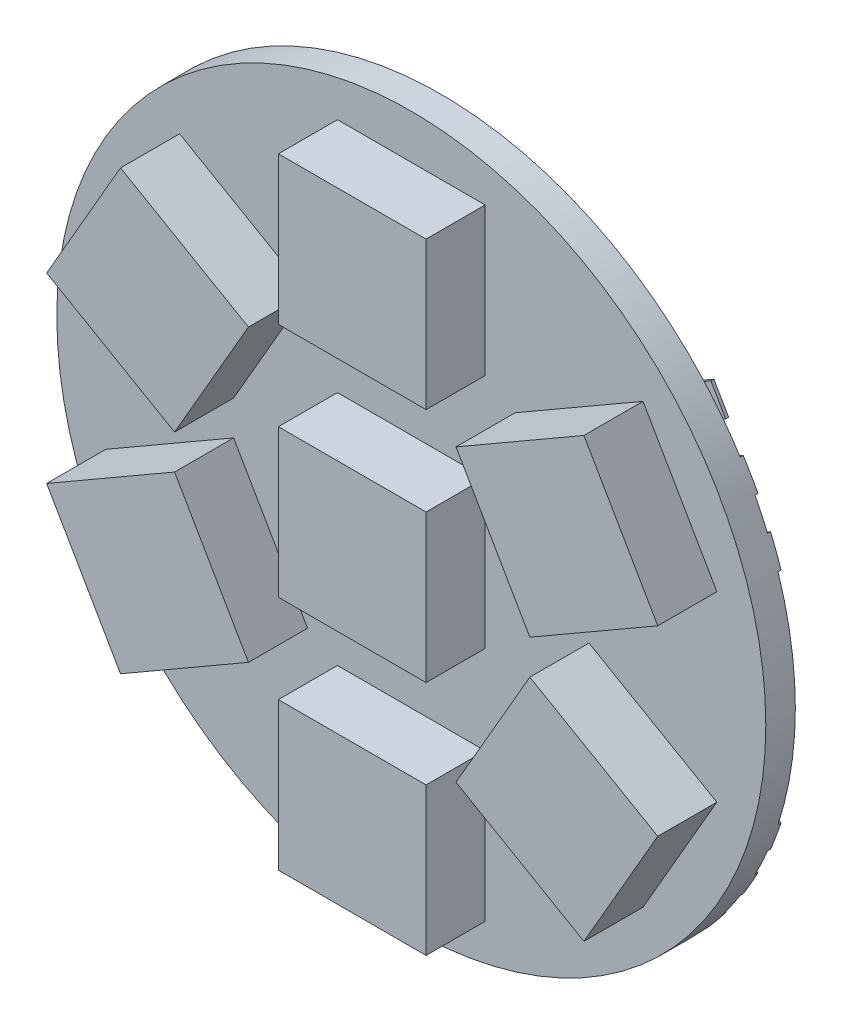
from build123d import *
from build123d.topology import SkipClean

# Parameters (mm, degrees)
CROQUIS1_R              = 12
SALIENTE_EXTRUIR1_DEPTH = 1
CROQUIS2_W              = 5
CROQUIS2_H              = 5
SALIENTE_EXTRUIR2_DEPTH = 2
SALIENTE_EXTRUIR3_START = 0.1
SALIENTE_EXTRUIR3_DEPTH = 0.1


with BuildPart() as part:
    # Croquis1 → Saliente-Extruir1 (new body)
    with BuildSketch(Plane.XY):
        Circle(CROQUIS1_R)
    extrude(amount=SALIENTE_EXTRUIR1_DEPTH)

    # Croquis2 → Saliente-Extruir2 (add)
    with BuildSketch(Plane.XY.offset(1)):
        Rectangle(CROQUIS2_W, CROQUIS2_H)
        with Locations((0, -8)):
            Rectangle(CROQUIS2_W, CROQUIS2_H)
        with Locations((0, 8)):
            Rectangle(CROQUIS2_W, CROQUIS2_H)
        Polygon((-7.84326674, 7.415063509), (-10.34326674, 3.084936491), (-6.013139721, 0.584936491), (-3.513139721, 4.915063509), align=None)
        Polygon((-6.013139721, -0.584936491), (-10.34326674, -3.084936491), (-7.84326674, -7.415063509), (-3.513139721, -4.915063509), align=None)
        Polygon((6.013139721, -0.584936491), (3.513139721, -4.915063509), (7.84326674, -7.415063509), (10.34326674, -3.084936491), align=None)
        Polygon((7.84326674, 7.415063509), (3.513139721, 4.915063509), (6.013139721, 0.584936491), (10.34326674, 3.084936491), align=None)
    extrude(amount=SALIENTE_EXTRUIR2_DEPTH)

    # Croquis3 → Saliente-Extruir3 (add)
    with SkipClean():  # the faces are left unmerged after this step: merging them gives an invalid solid
        with BuildSketch(Plane(origin=(0, 0, 0), x_dir=(-1, 0, 0), z_dir=(0, 0, -1)).offset(SALIENTE_EXTRUIR3_START)):
            with BuildLine():
                ThreePointArc((-9.560795314, -7.251978556), (-9.245794779, -7.649528018), (-8.914275675, -8.033410807))
                Line((-8.914275675, -8.033410807), (-5.67820323, -6.165063509))
                Line((-5.67820323, -6.165063509), (-6.17820323, -5.299038106))
                Line((-6.17820323, -5.299038106), (-9.560795314, -7.251978556))
            make_face()
            with BuildLine():
                Line((-7.17820323, -3.566987298), (-10.633279829, -5.561776702))
                ThreePointArc((-10.633279829, -5.561776702), (-10.515075861, -5.78214317), (-10.392305608, -5.999998679))
                ThreePointArc((-10.392305608, -5.999998679), (-10.265021594, -6.215249929), (-10.133279829, -6.427802106))
                Line((-10.133279829, -6.427802106), (-6.67820323, -4.433012702))
                Line((-6.67820323, -4.433012702), (-7.17820323, -3.566987298))
            make_face()
            with BuildLine():
                Line((-8.17820323, -1.834936491), (-11.414275675, -3.703283788))
                ThreePointArc((-11.414275675, -3.703283788), (-11.24758298, -4.182329148), (-11.060795314, -4.653902344))
                Line((-11.060795314, -4.653902344), (-7.67820323, -2.700961894))
                Line((-7.67820323, -2.700961894), (-8.17820323, -1.834936491))
            make_face()
            with BuildLine():
                Line((-7.67820323, 2.700961894), (-11.060795314, 4.653902344))
                ThreePointArc((-11.060795314, 4.653902344), (-11.24758298, 4.182329148), (-11.414275675, 3.703283788))
                Line((-11.414275675, 3.703283788), (-8.17820323, 1.834936491))
                Line((-8.17820323, 1.834936491), (-7.67820323, 2.700961894))
            make_face()
            with BuildLine():
                ThreePointArc((-10.133279829, 6.427802106), (-10.265021594, 6.215249929), (-10.392305608, 5.999998679))
                ThreePointArc((-10.392305608, 5.999998679), (-10.515075861, 5.78214317), (-10.633279829, 5.561776702))
                Line((-10.633279829, 5.561776702), (-7.17820323, 3.566987298))
                Line((-7.17820323, 3.566987298), (-6.67820323, 4.433012702))
                Line((-6.67820323, 4.433012702), (-10.133279829, 6.427802106))
            make_face()
            Polygon((-9.642304845, 7.299038106), (-6.17820323, 5.299038106), (-5.67820323, 6.165063509), (-9.142304845, 8.165063509), align=None)
        extrude(amount=-SALIENTE_EXTRUIR3_DEPTH)


solid = part.part
